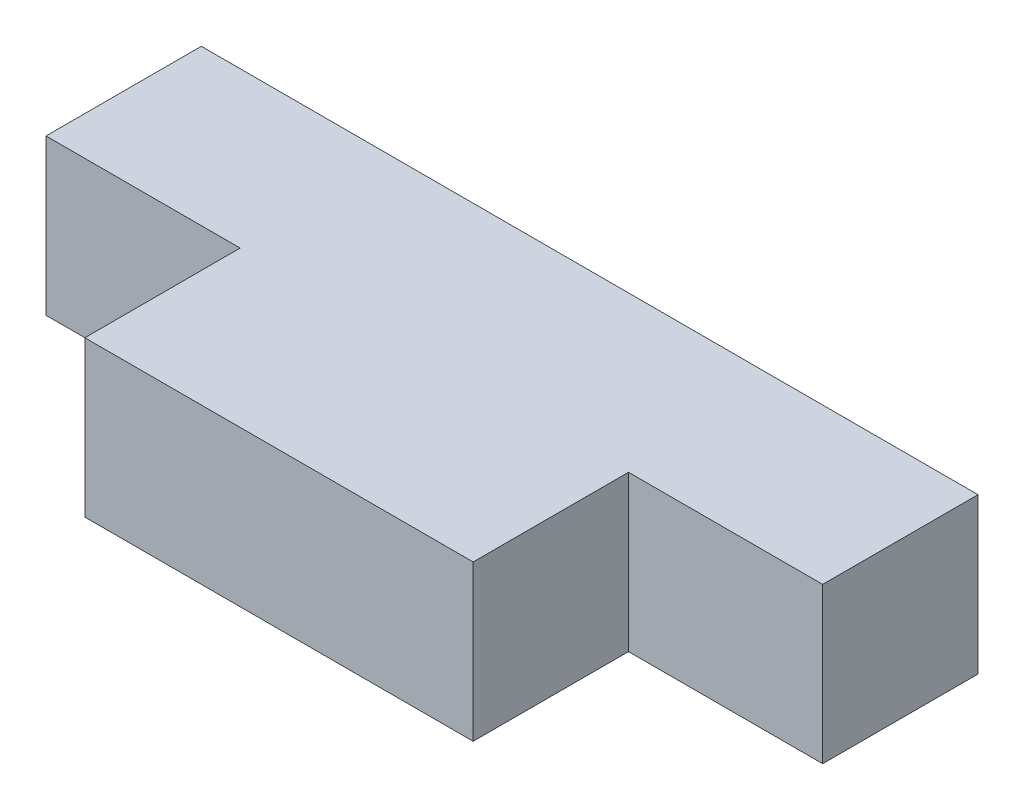
from build123d import *

# Parameters (mm, degrees)
BOSS_EXTRUDE1_DEPTH = 6


with BuildPart() as part:
    # Sketch1 → Boss-Extrude1 (new body)
    with BuildSketch(Plane(origin=(0, 0, 0), x_dir=(1, 0, 0), z_dir=(0, 1, 0))):
        Polygon((-37.645597261, 14.807112675), (-37.645597261, 8.807112675), (-22.645597261, 8.807112675), (-22.645597261, 14.807112675), (-15.145597261, 14.807112675), (-15.145597261, 20.807112675), (-45.145597261, 20.807112675), (-45.145597261, 14.807112675), align=None)
    extrude(amount=BOSS_EXTRUDE1_DEPTH)


solid = part.part
